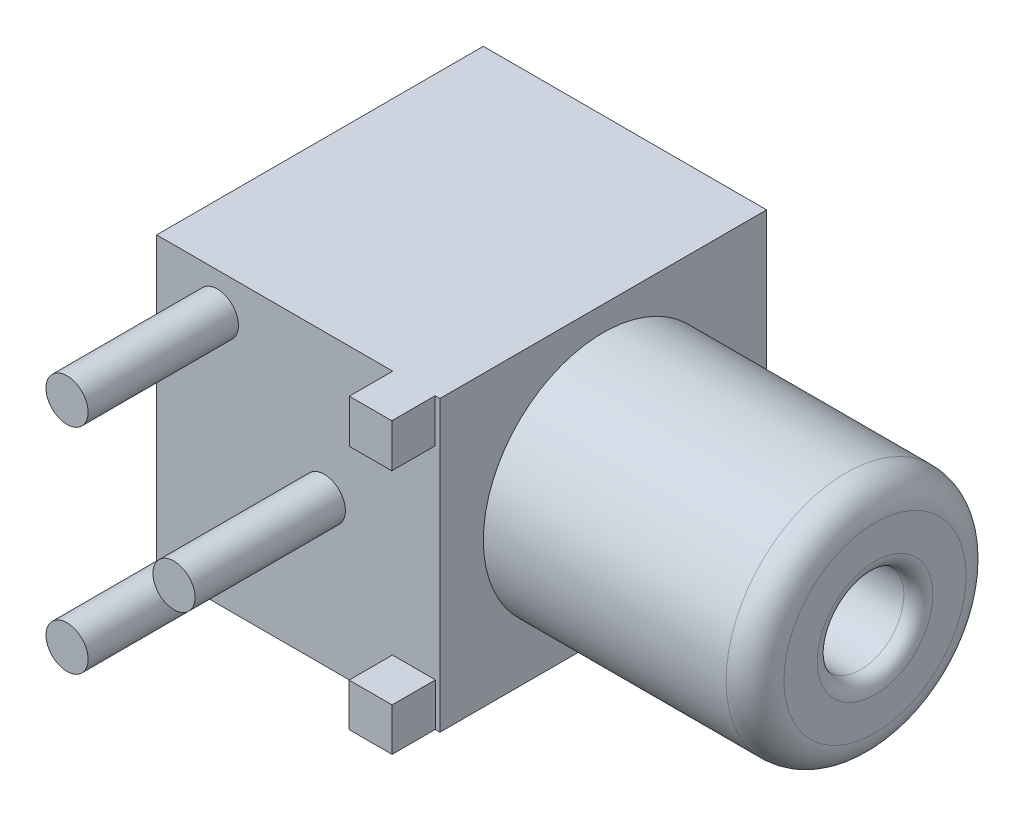
from build123d import *

# Parameters (mm, degrees)
SKETCH5_R             = 0.729
BOSS_EXTRUDE1_DEPTH   = 5.2
BOSS_EXTRUDE1_2_DEPTH = 5.2
BOSS_EXTRUDE1_3_DEPTH = 5.2
SKETCH6_W             = 9.8
SKETCH6_H             = 10
BOSS_EXTRUDE2_DEPTH   = 11.3
SKETCH8_R             = 4.15
BOSS_EXTRUDE3_DEPTH   = 9.4
SKETCH9_R             = 1.5
CUT_EXTRUDE1_DEPTH    = 9.4
FILLET1_R             = 1
FILLET2_R             = 0.5
SKETCH10_W            = 1.469693846
SKETCH10_H            = 1.5
SKETCH10_W_2          = 1.486314294
SKETCH10_H_2          = 1.483532886
BOSS_EXTRUDE4_DEPTH   = 1.5


with BuildPart() as part:
    # Sketch5 → Boss-Extrude1 (new body)
    with BuildSketch(Plane.XY):
        with Locations((44.56, 20.21)):
            Circle(SKETCH5_R)
    extrude(amount=BOSS_EXTRUDE1_DEPTH)



with BuildPart() as body_2:
    # Sketch5 → Boss-Extrude1 2 (new body)
    with BuildSketch(Plane.XY):
        with Locations((44.56, 12.81)):
            Circle(SKETCH5_R)
    extrude(amount=BOSS_EXTRUDE1_2_DEPTH)


with BuildPart() as body_3:
    # Sketch5 → Boss-Extrude1 3 (new body)
    with BuildSketch(Plane.XY):
        with Locations((48.26, 16.51)):
            Circle(SKETCH5_R)
    extrude(amount=BOSS_EXTRUDE1_3_DEPTH)


with BuildPart() as part_1:
    add(part.part)

    add(body_2.part)  # Boss-Extrude2 merges body 2

    add(body_3.part)  # Boss-Extrude2 merges body 3
    # Sketch6 → Boss-Extrude2 (add)
    with BuildSketch(Plane.XY):
        with Locations((47.36, 16.51)):
            Rectangle(SKETCH6_W, SKETCH6_H)
    extrude(amount=-BOSS_EXTRUDE2_DEPTH)

    # Sketch8 → Boss-Extrude3 (add)
    with BuildSketch(Plane(origin=(52.26, 0, 0), x_dir=(0, 0, -1), z_dir=(1, 0, 0))):
        with Locations((5.65, 16.51)):
            Circle(SKETCH8_R)
    extrude(amount=BOSS_EXTRUDE3_DEPTH)

    # Sketch9 → Cut-Extrude1 (cut)
    with BuildSketch(Plane(origin=(61.66, 0, 0), x_dir=(0, 0, -1), z_dir=(1, 0, 0))):
        with Locations((5.65, 16.51)):
            Circle(SKETCH9_R)
    extrude(amount=-CUT_EXTRUDE1_DEPTH, mode=Mode.SUBTRACT)

    # Fillet1
    fillet1_edges = [part_1.edges().sort_by_distance(p)[0] for p in [
        (61.66, 16.51, -1.5),
    ]]
    fillet(fillet1_edges, radius=FILLET1_R)

    # Fillet2
    fillet2_edges = [part_1.edges().sort_by_distance(p)[0] for p in [
        (61.66, 16.51, -4.15),
    ]]
    fillet(fillet2_edges, radius=FILLET2_R)

    # Sketch10 → Boss-Extrude4 (add)
    with BuildSketch(Plane.XY):
        with Locations((51.36, 20.76)):
            Rectangle(SKETCH10_W, SKETCH10_H)
        with Locations((51.36, 12.26)):
            Rectangle(SKETCH10_W_2, SKETCH10_H_2)
    extrude(amount=BOSS_EXTRUDE4_DEPTH)


solid = part_1.part
